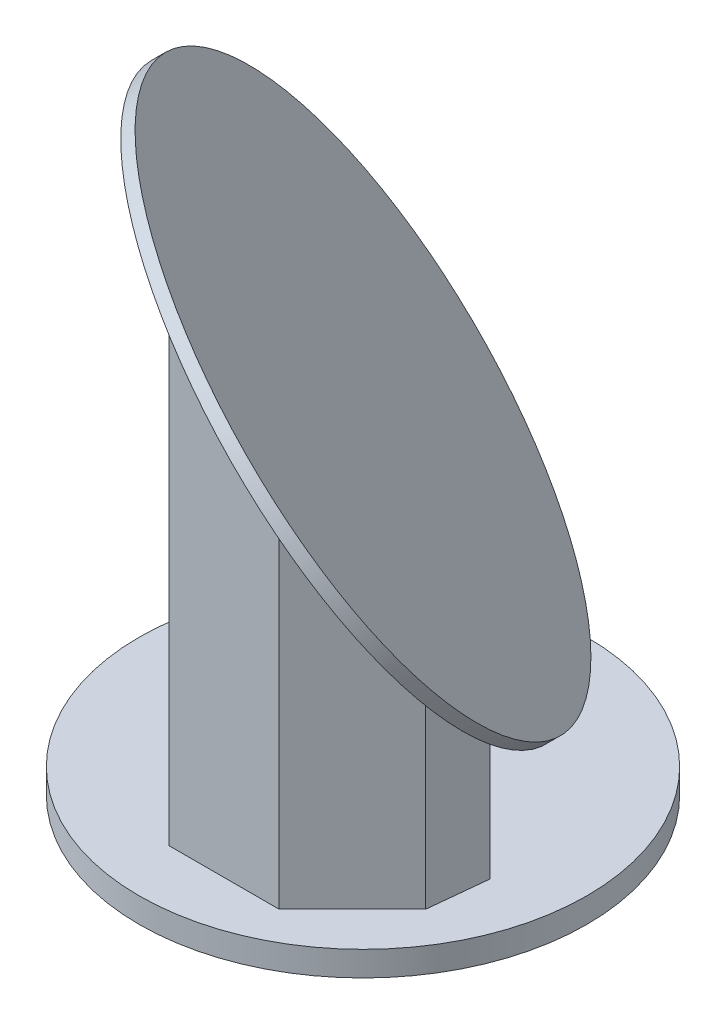
from build123d import *

# Parameters (mm, degrees)
SKETCH_3_R      = 112.5
EXTRUDE_5_DEPTH = 5
EXTRUDE_1_REACH = 465.242
SKETCH_8_R      = 90.24770546
EXTRUDE_2_DEPTH = 10


with BuildPart() as part:
    # 草图3 → 凸台-拉伸5 (new body)
    with BuildSketch(Plane(origin=(0, 0, 0), x_dir=(-0.4082482904638631, -0.40824829046386274, -0.8164965809277263), z_dir=(0.5773502691896261, 0.5773502691896257, -0.5773502691896256))):
        Circle(SKETCH_3_R)
    extrude(amount=-EXTRUDE_5_DEPTH)

    # 凸台-拉伸1: up to this plane
    extrude_1_end = Plane(origin=(-2.886751346, -2.886751346, 2.886751346), z_dir=(0.5773502691896261, 0.5773502691896257, -0.5773502691896256))
    # 草图5 → 凸台-拉伸1 (add, up to the surface)
    with BuildSketch(Plane(origin=(0, -140, 0), x_dir=(1, 0, 0), z_dir=(0, 1, 0)), mode=Mode.PRIVATE) as extrude_1_sk1:
        Polygon((-37.158068765, 62.446542524), (-66.718597501, 32.886013788), (-66.718597501, -11.451165298), (-11.451165298, -66.718597501), (32.886013788, -66.718597501), (62.446542524, -37.158068765), (64.849763198, -13.752243339), (-13.752243339, 64.849763198), align=None)
    extrude_1_tool1 = split(extrude(extrude_1_sk1.sketch, amount=EXTRUDE_1_REACH, mode=Mode.PRIVATE), bisect_by=extrude_1_end, keep=Keep.BOTH, mode=Mode.PRIVATE)
    add(extrude_1_tool1.solids().sort_by_distance((-5.313204, -140, 5.313204))[0])

    # 草图8 → 凸台-拉伸2 (add)
    with BuildSketch(Plane(origin=(0, -140, 0), x_dir=(1, 0, 0), z_dir=(0, 1, 0))):
        Circle(SKETCH_8_R)
    extrude(amount=EXTRUDE_2_DEPTH)


solid = part.part
